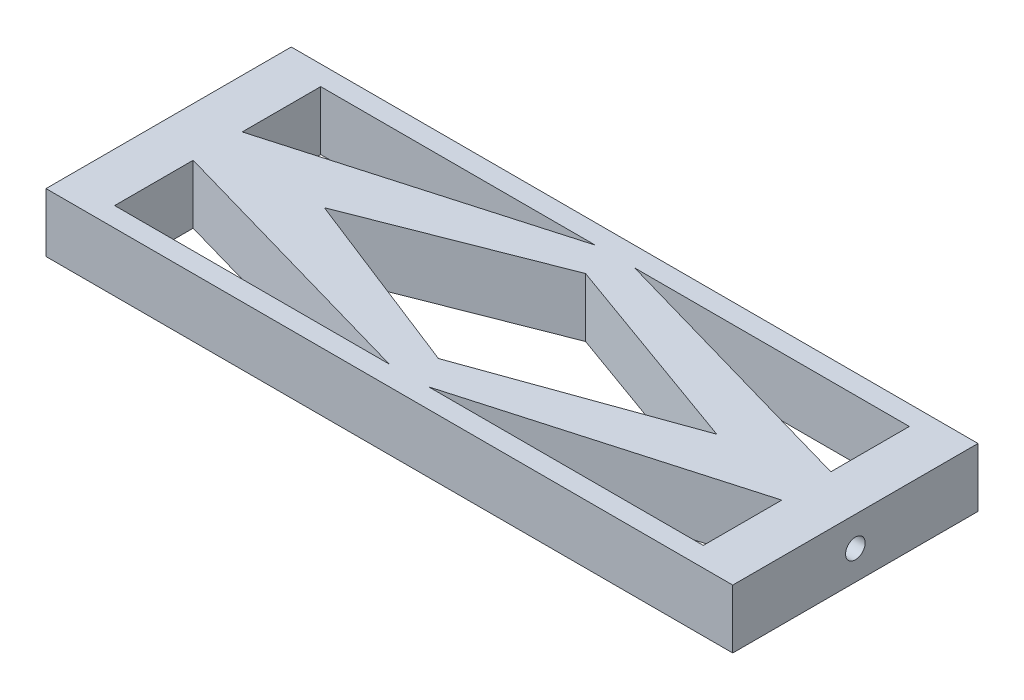
from build123d import *

# Parameters (mm, degrees)
SKETCH1_W           = 88.9
SKETCH1_H           = 31.75
BOSS_EXTRUDE1_DEPTH = 7.62
CUT_EXTRUDE1_DEPTH  = 29.464
CUT_EXTRUDE2_DEPTH  = 29.464
SKETCH4_R           = 1.27
CUT_EXTRUDE3_DEPTH  = 7.62
SKETCH5_R           = 1.27
CUT_EXTRUDE4_DEPTH  = 7.62


with BuildPart() as part:
    # Sketch1 → Boss-Extrude1 (new body)
    with BuildSketch(Plane(origin=(0, 0, 0), x_dir=(1, 0, 0), z_dir=(0, 1, 0))):
        Rectangle(SKETCH1_W, SKETCH1_H)
    extrude(amount=BOSS_EXTRUDE1_DEPTH)

    # Sketch2 → Cut-Extrude1 (cut)
    with BuildSketch(Plane(origin=(0, 7.62, 0), x_dir=(1, 0, 0), z_dir=(0, 1, 0))):
        Polygon((-38.1, 3.175), (-38.1, 13.335), (-2.563992866, 13.335), align=None)
        Polygon((-38.1, -3.175), (-38.1, -13.335), (-2.563992866, -13.335), align=None)
        Polygon((2.54, 13.335), (38.1, 13.335), (38.1, 3.175), align=None)
        Polygon((38.1, -3.175), (38.1, -13.335), (2.54, -13.335), align=None)
    extrude(amount=-CUT_EXTRUDE1_DEPTH, mode=Mode.SUBTRACT)

    # Sketch3 → Cut-Extrude2 (cut)
    with BuildSketch(Plane(origin=(0, 7.62, 0), x_dir=(1, 0, 0), z_dir=(0, 1, 0))):
        Polygon((0, 9.525), (-24.292421741, 0), (0, -9.525), (26.507578259, 0), align=None)
    extrude(amount=-CUT_EXTRUDE2_DEPTH, mode=Mode.SUBTRACT)

    # Sketch4 → Cut-Extrude3 (cut)
    with BuildSketch(Plane(origin=(44.45, 0, 0), x_dir=(0, 0, -1), z_dir=(1, 0, 0))):
        with Locations((0, 3.786925891)):
            Circle(SKETCH4_R)
    extrude(amount=-CUT_EXTRUDE3_DEPTH, mode=Mode.SUBTRACT)

    # Sketch5 → Cut-Extrude4 (cut)
    with BuildSketch(Plane.ZY.offset(44.45)):
        with Locations((0, 3.81)):
            Circle(SKETCH5_R)
    extrude(amount=-CUT_EXTRUDE4_DEPTH, mode=Mode.SUBTRACT)


solid = part.part
